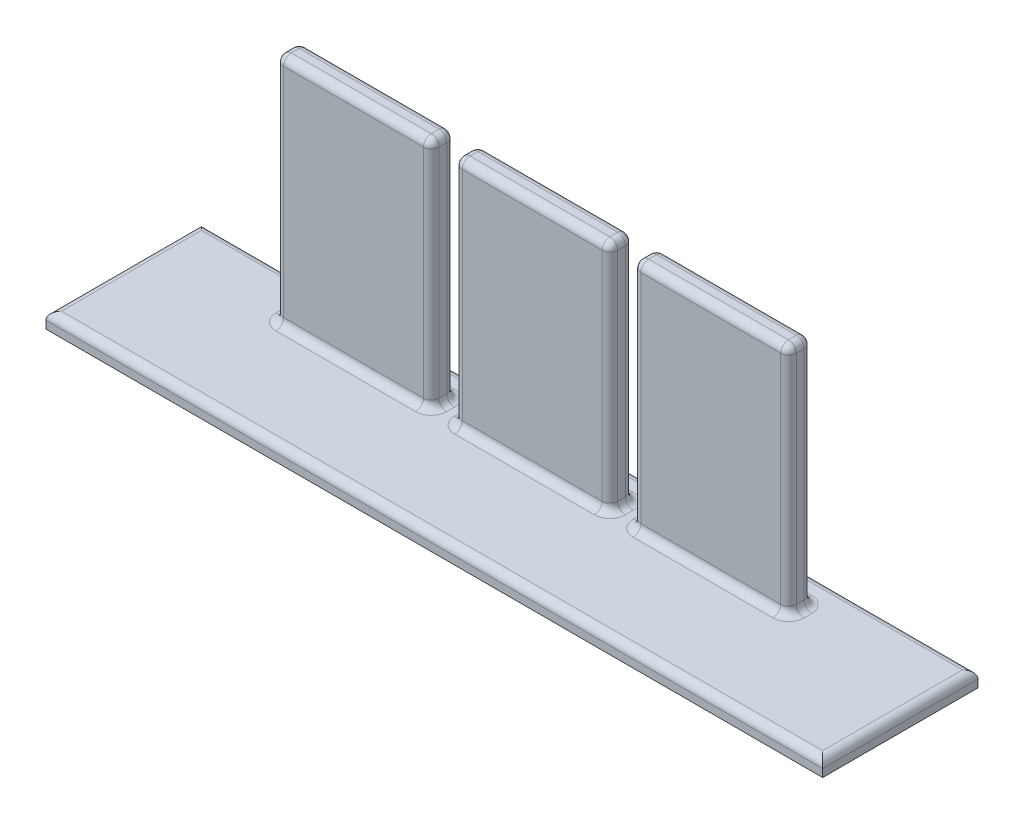
from build123d import *

# Parameters (mm, degrees)
SKETCH_1_W      = 50
SKETCH_1_H      = 1
EXTRUDE_1_DEPTH = 10
SKETCH_2_W      = 10
SKETCH_2_H      = 1.5
EXTRUDE_2_DEPTH = 15
FILLET_3_R      = 0.5


with BuildPart() as part:
    # 草图1 → 凸台-拉伸1 (new body)
    with BuildSketch(Plane.XY):
        with Locations((25, 0.5)):
            Rectangle(SKETCH_1_W, SKETCH_1_H)
    extrude(amount=EXTRUDE_1_DEPTH)

    # 草图2 → 凸台-拉伸2 (add)
    with BuildSketch(Plane(origin=(0, 1, 0), x_dir=(1, 0, 0), z_dir=(0, 1, 0))):
        with Locations((13, -2.45)):
            Rectangle(SKETCH_2_W, SKETCH_2_H)
        with Locations((24.5, -2.45)):
            Rectangle(SKETCH_2_W, SKETCH_2_H)
        with Locations((36, -2.45)):
            Rectangle(SKETCH_2_W, SKETCH_2_H)
    extrude(amount=EXTRUDE_2_DEPTH)

    # 圆角3
    fillet_3_edges = [part.edges().sort_by_distance(p)[0] for p in [
        (25, 1, 10),
        (8, 1, 2.45),
        (8, 8.5, 1.7),
        (13, 1, 3.2),
        (8, 8.5, 3.2),
        (18, 1, 2.45),
        (18, 8.5, 3.2),
        (13, 1, 1.7),
        (18, 8.5, 1.7),
        (8, 16, 2.45),
        (13, 16, 3.2),
        (18, 16, 2.45),
        (13, 16, 1.7),
        (19.5, 1, 2.45),
        (19.5, 8.5, 1.7),
        (24.5, 1, 3.2),
        (19.5, 8.5, 3.2),
        (29.5, 1, 2.45),
        (29.5, 8.5, 3.2),
        (24.5, 1, 1.7),
        (29.5, 8.5, 1.7),
        (19.5, 16, 2.45),
        (24.5, 16, 3.2),
        (29.5, 16, 2.45),
        (24.5, 16, 1.7),
        (31, 1, 2.45),
        (31, 8.5, 1.7),
        (36, 1, 3.2),
        (31, 8.5, 3.2),
        (41, 1, 2.45),
        (41, 8.5, 3.2),
        (36, 1, 1.7),
        (41, 8.5, 1.7),
        (31, 16, 2.45),
        (36, 16, 3.2),
        (41, 16, 2.45),
        (36, 16, 1.7),
        (25, 1, 0),
        (0, 1, 5),
        (50, 1, 5),
    ]]
    fillet(fillet_3_edges, radius=FILLET_3_R)


solid = part.part
